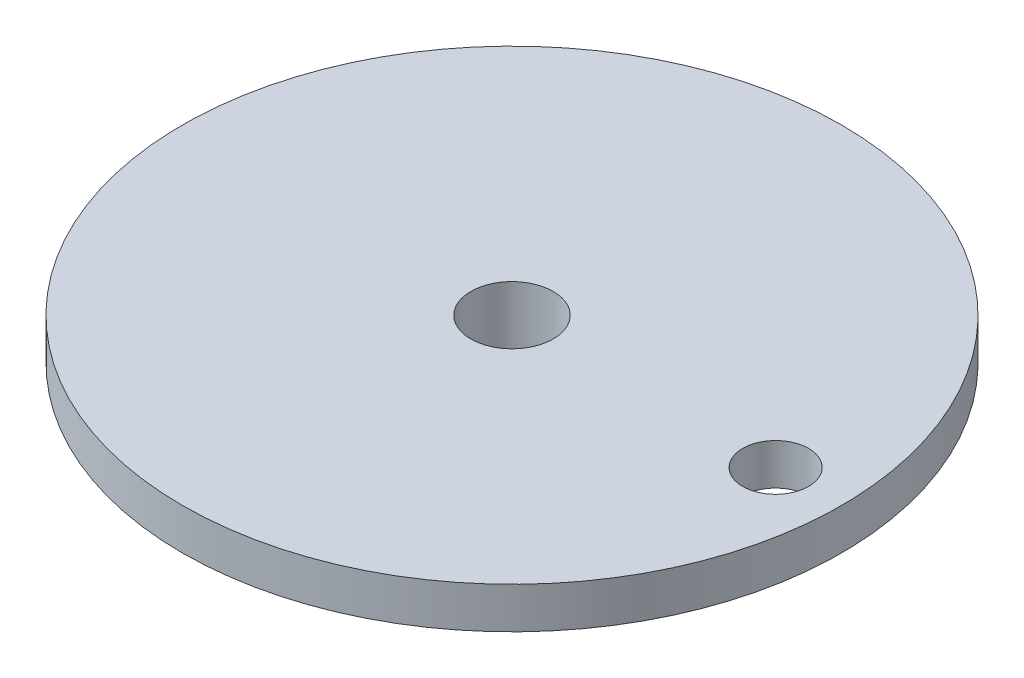
from build123d import *

# Parameters (mm, degrees)
SKETCH1_R           = 40
BOSS_EXTRUDE1_DEPTH = 5
SKETCH2_R           = 11
BOSS_EXTRUDE2_DEPTH = 5
SKETCH3_R           = 5
CUT_EXTRUDE1_DEPTH  = 58.445626465
SKETCH4_R           = 4
CUT_EXTRUDE2_DEPTH  = 57.789083458


with BuildPart() as part:
    # Sketch1 → Boss-Extrude1 (new body)
    with BuildSketch(Plane(origin=(0, 0, 0), x_dir=(1, 0, 0), z_dir=(0, 1, 0))):
        with Locations(Location((0, 0, 0), (0, 0, 270))):
            Circle(SKETCH1_R)
    extrude(amount=BOSS_EXTRUDE1_DEPTH)

    # Sketch2 → Boss-Extrude2 (add)
    with BuildSketch(Plane.XZ):
        with Locations(Location((0, 0, 0), (0, 0, 270))):
            Circle(SKETCH2_R)
    extrude(amount=BOSS_EXTRUDE2_DEPTH)

    # Sketch3 → Cut-Extrude1 (cut, through all)
    with BuildSketch(Plane.XZ.offset(5)):
        with Locations(Location((0, 0, 0), (0, 0, 270))):
            Circle(SKETCH3_R)
    extrude(amount=-CUT_EXTRUDE1_DEPTH, mode=Mode.SUBTRACT)

    # Sketch4 → Cut-Extrude2 (cut, through all)
    with BuildSketch(Plane.XZ):
        with Locations(Location((32, 0, 0), (0, 0, 270))):
            Circle(SKETCH4_R)
    extrude(amount=-CUT_EXTRUDE2_DEPTH, mode=Mode.SUBTRACT)


solid = part.part
